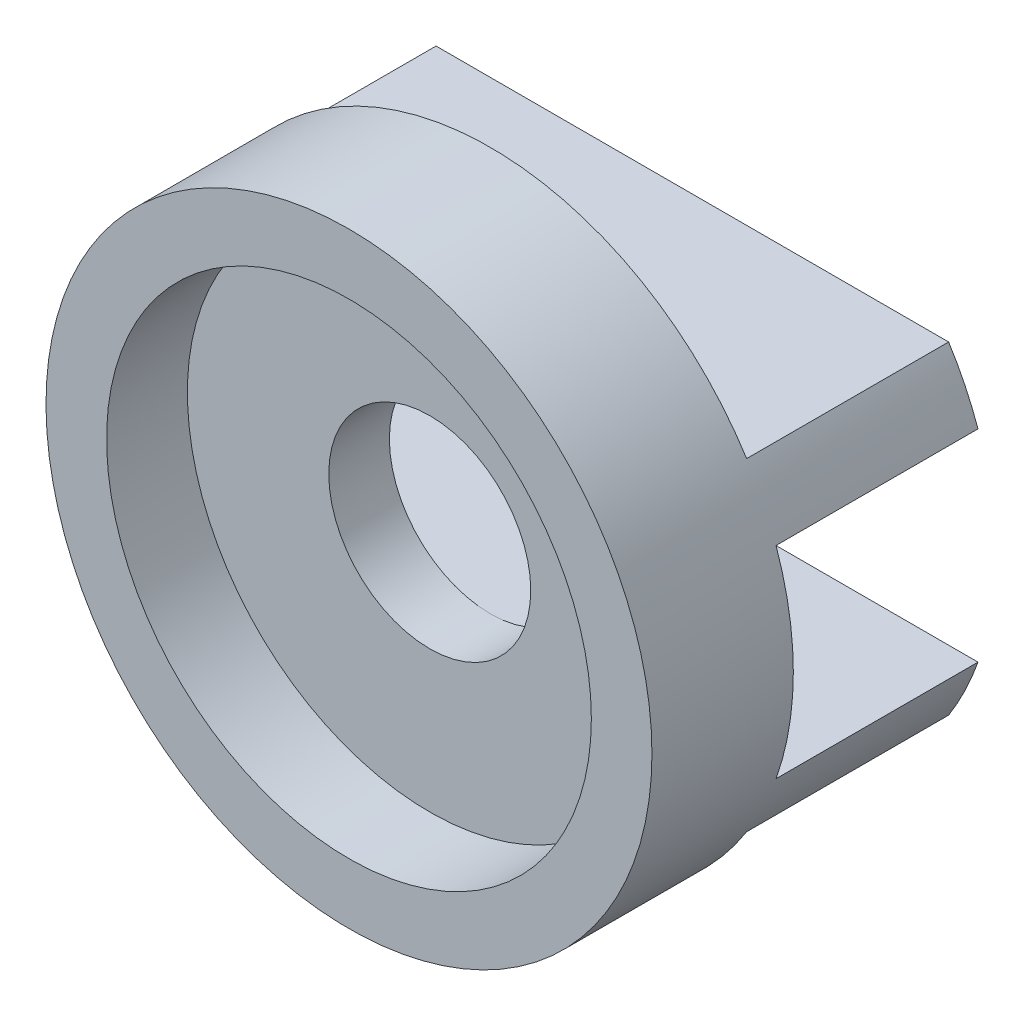
from build123d import *
from build123d.topology import SkipClean

# Parameters (mm, degrees)
CROQUIS1_R              = 75
SALIENTE_EXTRUIR1_DEPTH = 15
SALIENTE_EXTRUIR2_START = 50
SALIENTE_EXTRUIR2_DEPTH = 50
CROQUIS3_R              = 75
CROQUIS3_R_2            = 60
SALIENTE_EXTRUIR3_DEPTH = 20
CROQUIS4_R              = 25
CORTAR_EXTRUIR1_DEPTH   = 20


with BuildPart() as part:
    # Croquis1 → Saliente-Extruir1 (new body)
    with BuildSketch(Plane.XY):
        Circle(CROQUIS1_R)
    extrude(amount=SALIENTE_EXTRUIR1_DEPTH)

    # Croquis2 → Saliente-Extruir2 (add)
    with SkipClean():  # the faces are left unmerged after this step: merging them gives an invalid solid
        with BuildSketch(Plane(origin=(0, 0, 0), x_dir=(-1, 0, 0), z_dir=(0, 0, -1)).offset(SALIENTE_EXTRUIR2_START)):
            with BuildLine():
                Line((-70.710678119, 25), (0, 25))
                Line((0, 25), (0, 40))
                Line((0, 40), (-63.442887702, 40))
                ThreePointArc((-63.442887702, 40), (-67.494776136, 32.70252581), (-70.710678119, 25))
            make_face()
            with BuildLine():
                Line((0, 40), (0, 25))
                Line((0, 25), (70.710678119, 25))
                ThreePointArc((70.710678119, 25), (67.494776136, 32.70252581), (63.442887702, 40))
                Line((63.442887702, 40), (0, 40))
            make_face()
            with BuildLine():
                Line((-70.710678119, 25), (0, 25))
                Line((0, 25), (0, 40))
                Line((0, 40), (-63.442887702, 40))
                ThreePointArc((-63.442887702, 40), (-67.494776136, 32.70252581), (-70.710678119, 25))
            make_face()
            with BuildLine():
                Line((0, -40), (0, -25))
                Line((0, -25), (-70.710678119, -25))
                ThreePointArc((-70.710678119, -25), (-67.494776136, -32.70252581), (-63.442887702, -40))
                Line((-63.442887702, -40), (0, -40))
            make_face()
            with BuildLine():
                Line((70.710678119, -25), (0, -25))
                Line((0, -25), (0, -40))
                Line((0, -40), (63.442887702, -40))
                ThreePointArc((63.442887702, -40), (67.494776136, -32.70252581), (70.710678119, -25))
            make_face()
            with BuildLine():
                Line((0, -40), (0, -25))
                Line((0, -25), (-70.710678119, -25))
                ThreePointArc((-70.710678119, -25), (-67.494776136, -32.70252581), (-63.442887702, -40))
                Line((-63.442887702, -40), (0, -40))
            make_face()
            with BuildLine():
                Line((70.710678119, -25), (0, -25))
                Line((0, -25), (0, -40))
                Line((0, -40), (63.442887702, -40))
                ThreePointArc((63.442887702, -40), (67.494776136, -32.70252581), (70.710678119, -25))
            make_face()
        extrude(amount=-SALIENTE_EXTRUIR2_DEPTH)

    # Croquis3 → Saliente-Extruir3 (add)
    with SkipClean():  # the faces are left unmerged after this step: merging them gives an invalid solid
        with BuildSketch(Plane.XY.offset(15)):
            with Locations(Location((0, 0, 0), (0, 0, 160.528779366))):
                Circle(CROQUIS3_R)
            Circle(CROQUIS3_R_2, mode=Mode.SUBTRACT)
        extrude(amount=SALIENTE_EXTRUIR3_DEPTH)

    # Croquis4 → Cortar-Extruir1 (cut)
    with SkipClean():  # the faces are left unmerged after this step: merging them gives an invalid solid
        with BuildSketch(Plane.XY.offset(15)):
            Circle(CROQUIS4_R)
        extrude(amount=-CORTAR_EXTRUIR1_DEPTH, mode=Mode.SUBTRACT)


solid = part.part
